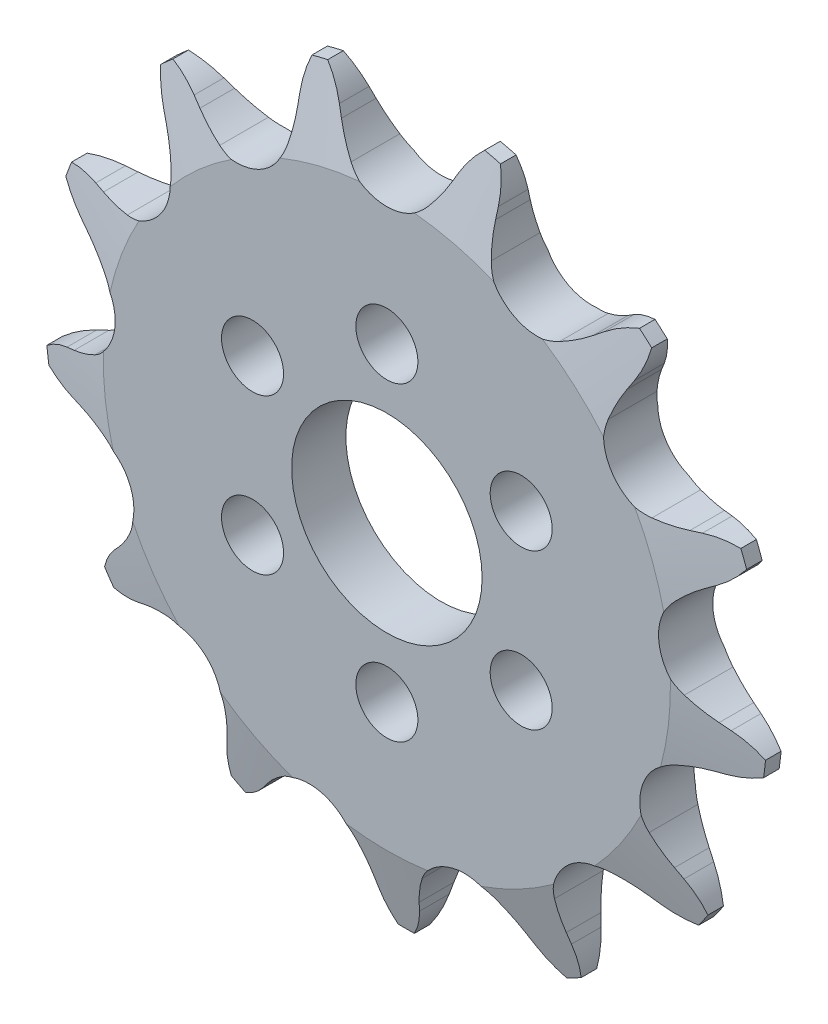
from build123d import *

# Parameters (mm, degrees)
CUT_EXTRUDE1_DEPTH      = 53.351870728
CIRPATTERN1_COUNT       = 13
CUT_EXTRUDE2_DEPTH      = 53.225813528
CUT_EXTRUDE2_DEPTH_BACK = 53.225813528
SKETCH3_OUTSIDE_W       = 96.34
SKETCH3_OUTSIDE_H       = 95.814
SKETCH3_OUTSIDE_R       = 36.957
SKETCH3_OUTSIDE_R_2     = 9.75
SKETCH4_R               = 3.175
CUT_EXTRUDE3_DEPTH      = 53.434548787


with BuildPart() as part:
    # Sketch1 → Revolve1 (revolve)
    with BuildSketch(Plane(origin=(0, 0, 0), x_dir=(0, 0, -1), z_dir=(1, 0, 0)), mode=Mode.PRIVATE) as revolve1_sk:
        Polygon((2.778125, 0), (-2.778125, 0), (-2.778125, 29.028703417), (-0.79375, 36.966203417), (0.79375, 36.966203417), (2.778125, 29.028703417), align=None)
    revolve(revolve1_sk.sketch.rotate(Axis((0, 0, -2.778125), (0, 0, 1)), 90), axis=Axis((0, 0, -2.778125), (0, 0, 1)))

    # Sketch0 → Cut-Extrude1 (cut, symmetric)
    with BuildSketch(Plane.XY):
        with BuildLine():
            Line((13.954470356, -31.067878996), (13.281475664, -30.259243053))
            ThreePointArc((13.281475664, -30.259243053), (12.198620666, -29.105809316), (10.985992947, -28.089680215))
            ThreePointArc((10.985992947, -28.089680215), (6.712108073, -27.232092935), (3.326311638, -29.977622096))
            ThreePointArc((3.326311638, -29.977622096), (2.724801857, -31.440895931), (2.302008759, -32.965438593))
            Line((2.302008759, -32.965438593), (2.081893414, -33.99420639))
            ThreePointArc((2.081893414, -33.99420639), (-1.570781615, -39.344985469), (-7.926123198, -40.602962015))
            ThreePointArc((-7.926123198, -40.602962015), (9.900335889, -40.167241661), (25.887370848, -32.268684261))
            ThreePointArc((25.887370848, -32.268684261), (19.675384497, -34.108275848), (13.954470356, -31.067878996))
        make_face()
    cut_extrude1 = extrude(amount=CUT_EXTRUDE1_DEPTH, both=True, mode=Mode.SUBTRACT)

    # CirPattern1: Cut-Extrude1 ×13 about axis
    cirpattern1_axis = Axis((0, 0, 0), (0, 0, 1))
    for i in range(1, CIRPATTERN1_COUNT):
        add(cut_extrude1.rotate(cirpattern1_axis, i * 360 / CIRPATTERN1_COUNT), mode=Mode.SUBTRACT)

    # Sketch3 outside → Cut-Extrude2 (cut, two sides: drawn at the far end of the back side and taken through both)
    # profile 1 of 2: a face of its own
    with BuildSketch(Plane.XY.offset(-CUT_EXTRUDE2_DEPTH_BACK)):
        with Locations((0, -0.442)):
            Rectangle(SKETCH3_OUTSIDE_W, SKETCH3_OUTSIDE_H)
        Circle(SKETCH3_OUTSIDE_R, mode=Mode.SUBTRACT)
    # profile 2 of 2: a face of its own
    with BuildSketch(Plane.XY.offset(-CUT_EXTRUDE2_DEPTH_BACK)):
        Circle(SKETCH3_OUTSIDE_R_2)
    extrude(amount=CUT_EXTRUDE2_DEPTH + CUT_EXTRUDE2_DEPTH_BACK, mode=Mode.SUBTRACT)

    # Sketch4 → Cut-Extrude3 (cut, through all)
    with BuildSketch(Plane(origin=(0, 0, -2.778125), x_dir=(-1, 0, 0), z_dir=(0, 0, -1))):
        with Locations((0, 15.875)):
            Circle(SKETCH4_R)
        with Locations((13.748153285, 7.9375)):
            Circle(SKETCH4_R)
        with Locations((13.748153285, -7.9375)):
            Circle(SKETCH4_R)
        with Locations((0, -15.875)):
            Circle(SKETCH4_R)
        with Locations((-13.748153285, -7.9375)):
            Circle(SKETCH4_R)
        with Locations((-13.748153285, 7.9375)):
            Circle(SKETCH4_R)
    extrude(amount=-CUT_EXTRUDE3_DEPTH, mode=Mode.SUBTRACT)


solid = part.part
